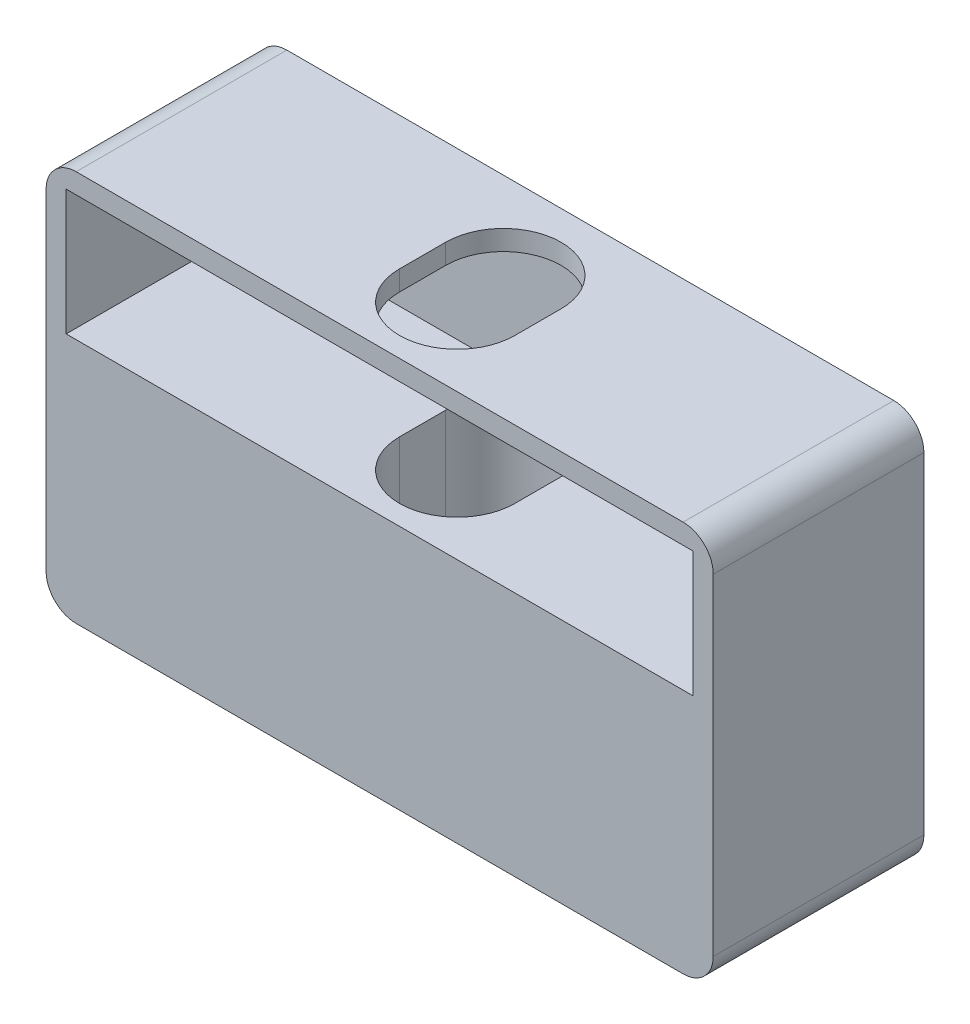
from build123d import *

# Parameters (mm, degrees)
SKETCH1_W           = 12.5
SKETCH1_H           = 2.5
BOSS_EXTRUDE1_DEPTH = 0.4
SKETCH1_3_W         = 13.3
SKETCH1_3_H         = 3.3
SKETCH1_3_W_2       = 12.5
SKETCH1_3_H_2       = 2.5
EXTRUDE_THIN1_DEPTH = 4.2
SKETCH2_W           = 13.3
SKETCH2_H           = 4.2
BOSS_EXTRUDE2_DEPTH = 4.5
CUT_EXTRUDE1_DEPTH  = 12.077116051
FILLET1_R           = 0.6


with BuildPart() as part:
    # Sketch1 → Boss-Extrude1 (new body)
    with BuildSketch(Plane.XY):
        Rectangle(SKETCH1_W, SKETCH1_H)
    extrude(amount=BOSS_EXTRUDE1_DEPTH)

    # Sketch1<3> → Extrude-Thin1 (add)
    with BuildSketch(Plane.XY):
        Rectangle(SKETCH1_3_W, SKETCH1_3_H)
        Rectangle(SKETCH1_3_W_2, SKETCH1_3_H_2, mode=Mode.SUBTRACT)
    extrude(amount=EXTRUDE_THIN1_DEPTH)

    # Sketch2 → Boss-Extrude2 (add)
    with BuildSketch(Plane.XZ.offset(1.65)):
        with Locations((0, 2.1)):
            Rectangle(SKETCH2_W, SKETCH2_H)
    extrude(amount=BOSS_EXTRUDE2_DEPTH)

    # Sketch3 → Cut-Extrude1 (cut, through all)
    with BuildSketch(Plane(origin=(0, 1.65, 0), x_dir=(1, 0, 0), z_dir=(0, 1, 0))):
        with BuildLine():
            Line((1.15, -1.733499425), (1.15, -2.654986585))
            ThreePointArc((1.15, -2.654986585), (0, -3.804986585), (-1.15, -2.654986585))
            Line((-1.15, -2.654986585), (-1.15, -1.733499425))
            ThreePointArc((-1.15, -1.733499425), (0, -0.583499425), (1.15, -1.733499425))
        make_face()
    extrude(amount=-CUT_EXTRUDE1_DEPTH, mode=Mode.SUBTRACT)

    # Fillet1
    fillet1_edges = [part.edges().sort_by_distance(p)[0] for p in [
        (6.65, -6.15, 2.1),
        (6.65, 1.65, 2.1),
        (-6.65, 1.65, 2.1),
        (-6.65, -6.15, 2.1),
    ]]
    fillet(fillet1_edges, radius=FILLET1_R)


solid = part.part
